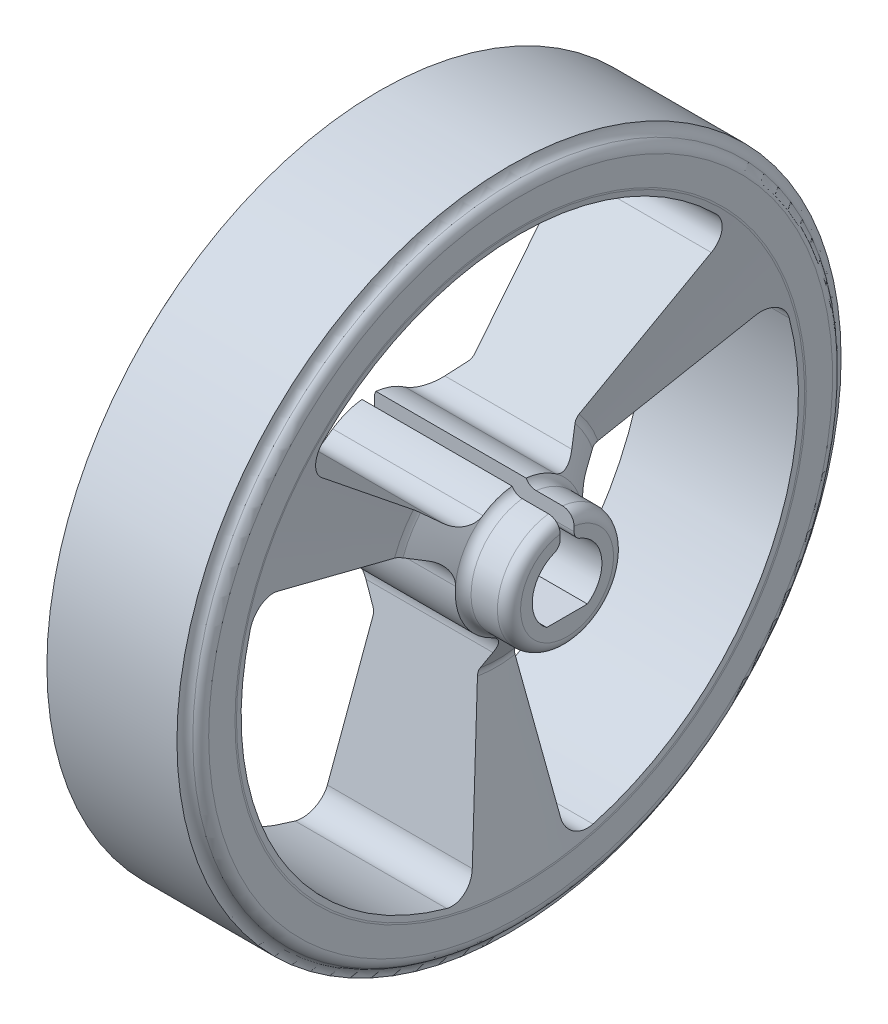
from build123d import *

# Parameters (mm, degrees)
CUT_EXTRUDE2_DEPTH = 22.975895886
CIRPATTERN1_COUNT  = 3
CUT_EXTRUDE3_DEPTH = 22.975895886
SCALE1_SCALE       = 3.6


with BuildPart() as part:
    # Sketch1 → Revolve1 (revolve)
    with BuildSketch(Plane(origin=(0, 0, 0), x_dir=(1, 0, 0), z_dir=(0, 1, 0)), mode=Mode.PRIVATE) as revolve1_sk:
        with BuildLine():
            Line((0, 0), (0, 2.5))
            ThreePointArc((0, 2.5), (0.017037087, 2.629409523), (0.066987298, 2.75))
            Line((0.066987298, 2.75), (0.98771433, 4.344746))
            ThreePointArc((0.98771433, 4.344746), (1.045401255, 4.498757059), (1.05, 4.663153041))
            Line((1.05, 4.663153041), (0.004701629, 12.231592959))
            ThreePointArc((0.004701629, 12.231592959), (0.001176792, 12.265715789), (0, 12.3))
            Line((0, 12.3), (0, 13.433974596))
            ThreePointArc((0, 13.433974596), (0.066987298, 13.683974596), (0.25, 13.866987298))
            ThreePointArc((0.25, 13.866987298), (0.433012702, 14.05), (0.5, 14.3))
            Line((0.5, 14.3), (6.1, 14.3))
            ThreePointArc((6.1, 14.3), (6.166987298, 14.05), (6.35, 13.866987298))
            ThreePointArc((6.35, 13.866987298), (6.533012702, 13.683974596), (6.6, 13.433974596))
            Line((6.6, 13.433974596), (6.6, 12.3))
            ThreePointArc((6.6, 12.3), (6.598823208, 12.265715789), (6.595298371, 12.231592959))
            Line((6.595298371, 12.231592959), (5.55, 4.663153041))
            ThreePointArc((5.55, 4.663153041), (5.554598745, 4.498757059), (5.61228567, 4.344746))
            Line((5.61228567, 4.344746), (6.533012702, 2.75))
            ThreePointArc((6.533012702, 2.75), (6.716025404, 2.566987298), (6.966025404, 2.5))
            Line((6.966025404, 2.5), (8.1, 2.5))
            ThreePointArc((8.1, 2.5), (8.453553391, 2.353553391), (8.6, 2))
            Line((8.6, 2), (8.6, 0))
            Line((8.6, 0), (0, 0))
        make_face()
    revolve(revolve1_sk.sketch.rotate(Axis((0, 0, 0), (1, 0, 0)), 180), axis=Axis((0, 0, 0), (1, 0, 0)))

    # Sketch2 → Cut-Extrude2 (cut, symmetric)
    with BuildSketch(Plane(origin=(0, 0, 0), x_dir=(0, 0, -1), z_dir=(1, 0, 0))):
        with BuildLine():
            Line((8.391596431, 7.04138547), (2.768644011, 2.323168169))
            ThreePointArc((2.768644011, 2.323168169), (2.17353825, 2.090350038), (1.558961361, 2.265422582))
            ThreePointArc((1.558961361, 2.265422582), (0, 2.75), (-1.558961361, 2.265422582))
            ThreePointArc((-1.558961361, 2.265422582), (-2.17353825, 2.090350038), (-2.768644011, 2.323168169))
            Line((-2.768644011, 2.323168169), (-8.391596431, 7.04138547))
            ThreePointArc((-8.391596431, 7.04138547), (-8.747937455, 7.765692967), (-8.453245987, 8.517196269))
            ThreePointArc((-8.453245987, 8.517196269), (0, 12), (8.453245987, 8.517196269))
            ThreePointArc((8.453245987, 8.517196269), (8.747937455, 7.765692967), (8.391596431, 7.04138547))
        make_face()
    cut_extrude2 = extrude(amount=CUT_EXTRUDE2_DEPTH, both=True, mode=Mode.SUBTRACT)

    # CirPattern1: Cut-Extrude2 ×3 about axis
    cirpattern1_axis = Axis((0, 0, 0), (1, 0, 0))
    for i in range(1, CIRPATTERN1_COUNT):
        add(cut_extrude2.rotate(cirpattern1_axis, i * 360 / CIRPATTERN1_COUNT), mode=Mode.SUBTRACT)

    # Sketch3 → Cut-Extrude3 (cut, through all)
    with BuildSketch(Plane.ZY):
        with BuildLine():
            Line((0.875, -1.218349293), (-0.875, -1.218349293))
            ThreePointArc((-0.875, -1.218349293), (-1.48871199, 0.183675284), (-0.552631579, 1.394488558))
            ThreePointArc((-0.552631579, 1.394488558), (-0.369131923, 1.541571578), (-0.3, 1.766352173))
            Line((-0.3, 1.766352173), (-0.3, 2.733587387))
            ThreePointArc((-0.3, 2.733587387), (0, 2.75), (0.3, 2.733587387))
            Line((0.3, 2.733587387), (0.3, 1.766352173))
            ThreePointArc((0.3, 1.766352173), (0.369131923, 1.541571578), (0.552631579, 1.394488558))
            ThreePointArc((0.552631579, 1.394488558), (1.48871199, 0.183675284), (0.875, -1.218349293))
        make_face()
    extrude(amount=-CUT_EXTRUDE3_DEPTH, mode=Mode.SUBTRACT)


with BuildPart() as part_1:
    # Scale1: scaled about (3.358181092, -0.009699982, 3e-09)
    add(part.part.scale(SCALE1_SCALE).moved(Location((-8.731270839, 0.025219953, -8e-09))))


solid = part_1.part
